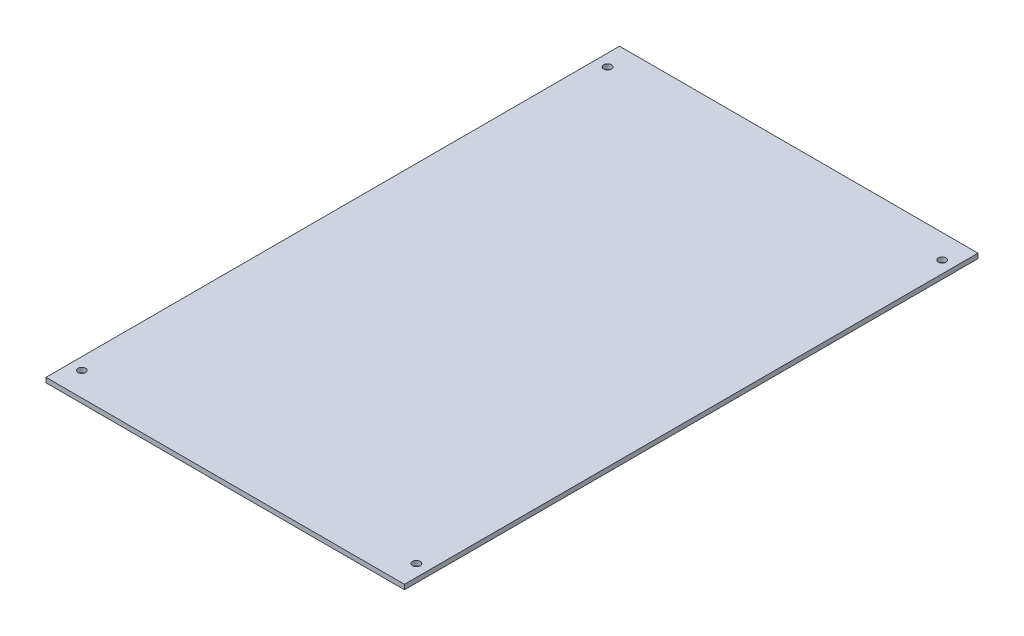
from build123d import *

# Parameters (mm, degrees)
SKETCH_1_W          = 150
SKETCH_1_H          = 240
EXTRUDE_1_DEPTH     = 2
SKETCH_2_R          = 1.6
CUT_EXTRUDE_1_DEPTH = 284.026500526


with BuildPart() as part:
    # Эскиз1 → Бобышка-Вытянуть1 (new body)
    with BuildSketch(Plane(origin=(0, 0, 0), x_dir=(1, 0, 0), z_dir=(0, 1, 0))):
        with Locations((75, 120)):
            Rectangle(SKETCH_1_W, SKETCH_1_H)
    extrude(amount=EXTRUDE_1_DEPTH)

    # Эскиз2 → Вырез-Вытянуть1 (cut, through all)
    with BuildSketch(Plane(origin=(0, 2, 0), x_dir=(1, 0, 0), z_dir=(0, 1, 0))):
        with Locations(Location((5, 230, 0), (0, 0, 270))):
            Circle(SKETCH_2_R)
        with Locations(Location((145, 230, 0), (0, 0, 90))):
            Circle(SKETCH_2_R)
        with Locations(Location((145, 10, 0), (0, 0, 270))):
            Circle(SKETCH_2_R)
        with Locations(Location((5, 10, 0), (0, 0, 90))):
            Circle(SKETCH_2_R)
    extrude(amount=-CUT_EXTRUDE_1_DEPTH, mode=Mode.SUBTRACT)


solid = part.part
